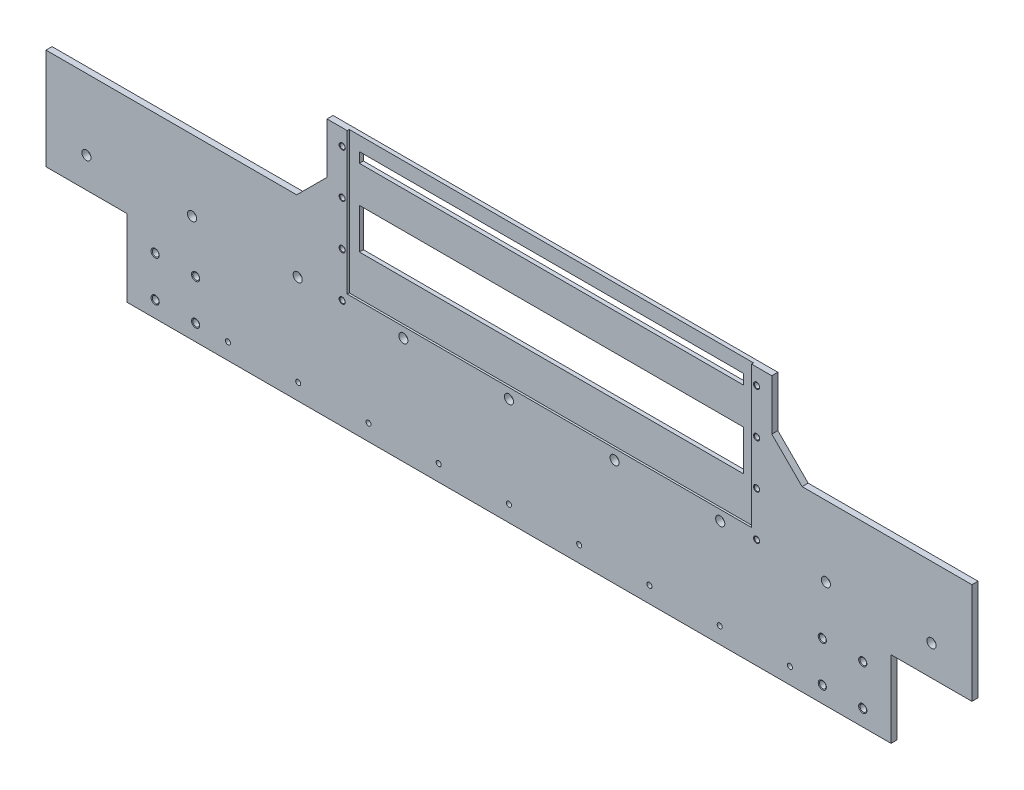
from build123d import *

# Parameters (mm, degrees)
EXTRUDE_1_DEPTH             = 3
SKETCH_2_W                  = 190
SKETCH_2_H                  = 5
SKETCH_2_H_2                = 20
CUT_EXTRUDE_1_DEPTH         = 4
SKETCH_3_W                  = 200
SKETCH_3_H                  = 70
CUT_EXTRUDE_2_DEPTH         = 1
EXTRUDE_2_DEPTH             = 3
CHAMFER_1_SIZE              = 15
HOLE_WIZARD_M41_D           = 3.3
HOLE_WIZARD_M41_DEPTH       = 11.5
HOLE_WIZARD_M41_CSINK_D     = 4.05
HOLE_WIZARD_M41_CSINK_ANGLE = 120
HOLE_WIZARD_M41_TIP         = 0.991420021
HOLE_WIZARD_M31_D           = 2.5
HOLE_WIZARD_M31_DEPTH       = 8.5
HOLE_WIZARD_M31_CSINK_D     = 3.05
HOLE_WIZARD_M31_CSINK_ANGLE = 120
HOLE_WIZARD_M31_TIP         = 0.751075774
HOLE_WIZARD_M32_D           = 2.5
HOLE_WIZARD_M32_DEPTH       = 8.5
HOLE_WIZARD_M32_CSINK_D     = 3.05
HOLE_WIZARD_M32_CSINK_ANGLE = 120
HOLE_WIZARD_M32_TIP         = 0.751075774
HOLE_WIZARD_M42_D           = 4.5
HOLE_WIZARD_M42_DEPTH       = 5
HOLE_WIZARD_M42_TIP         = 1.351936393


with BuildPart() as part:
    # Эскиз1 → Бобышка-Вытянуть1 (new body)
    with BuildSketch(Plane.XY):
        Polygon((259, 50), (298, 50), (298, 0), (0, 0), (0, 50), (39, 50), (39, 90), (259, 90), align=None)
    extrude(amount=EXTRUDE_1_DEPTH)

    # Эскиз2 → Вырез-Вытянуть1 (cut)
    with BuildSketch(Plane.XY.offset(3)):
        with Locations((149, 80.5)):
            Rectangle(SKETCH_2_W, SKETCH_2_H)
        with Locations((149, 50)):
            Rectangle(SKETCH_2_W, SKETCH_2_H_2)
    extrude(amount=-CUT_EXTRUDE_1_DEPTH, mode=Mode.SUBTRACT)

    # Эскиз3 → Вырез-Вытянуть2 (cut)
    with BuildSketch(Plane.XY.offset(3)):
        with Locations((149, 55)):
            Rectangle(SKETCH_3_W, SKETCH_3_H)
    extrude(amount=-CUT_EXTRUDE_2_DEPTH, mode=Mode.SUBTRACT)

    # Эскиз4 → Бобышка-Вытянуть2 (add)
    with BuildSketch(Plane.XY.offset(3)):
        Polygon((0, 50), (-100, 50), (-100, 0), (-60, 0), (-60, -38), (318, -38), (318, 0), (358, 0), (358, 50), (298, 50), (298, 0), (0, 0), align=None)
    extrude(amount=-EXTRUDE_2_DEPTH)

    # Фаска1
    chamfer_1_edges = [part.edges().sort_by_distance(p)[0] for p in [
        (39, 50, 1.5),
        (259, 50, 1.5),
    ]]
    chamfer(chamfer_1_edges, length=CHAMFER_1_SIZE)

    # Отверстие обработанное метчиком M41
    with Locations(Plane.XY.offset(3)):
        with Locations((-46, -30), (-26, -30), (-46, -10), (-26, -10), (284, -10), (304, -10), (304, -30), (284, -30)):
            CounterSinkHole(HOLE_WIZARD_M41_D / 2, HOLE_WIZARD_M41_CSINK_D / 2, depth=HOLE_WIZARD_M41_DEPTH, counter_sink_angle=HOLE_WIZARD_M41_CSINK_ANGLE)
            with Locations((0, 0, -(HOLE_WIZARD_M41_DEPTH + HOLE_WIZARD_M41_TIP / 2))):  # 118° drill point
                Cone(0, HOLE_WIZARD_M41_D / 2, HOLE_WIZARD_M41_TIP, mode=Mode.SUBTRACT)

    # Отверстие обработанное метчиком M31
    with Locations(Plane(origin=(0, 0, 0), x_dir=(-1, 0, 0), z_dir=(0, 0, -1))):
        with Locations((-268, -30), (-233.25, -30), (-198.5, -30), (-163.75, -30), (-129, -30), (-94.25, -30), (-59.5, -30), (-24.75, -30), (10, -30)):
            CounterSinkHole(HOLE_WIZARD_M31_D / 2, HOLE_WIZARD_M31_CSINK_D / 2, depth=HOLE_WIZARD_M31_DEPTH, counter_sink_angle=HOLE_WIZARD_M31_CSINK_ANGLE)
            with Locations((0, 0, -(HOLE_WIZARD_M31_DEPTH + HOLE_WIZARD_M31_TIP / 2))):  # 118° drill point
                Cone(0, HOLE_WIZARD_M31_D / 2, HOLE_WIZARD_M31_TIP, mode=Mode.SUBTRACT)

    # Отверстие обработанное метчиком M32
    with Locations(Plane.XY.offset(3)):
        with Locations((251.5, 82), (46.5, 82), (251.5, 60), (46.5, 60), (251.5, 38), (46.5, 38), (251.5, 16), (46.5, 16)):
            CounterSinkHole(HOLE_WIZARD_M32_D / 2, HOLE_WIZARD_M32_CSINK_D / 2, depth=HOLE_WIZARD_M32_DEPTH, counter_sink_angle=HOLE_WIZARD_M32_CSINK_ANGLE)
            with Locations((0, 0, -(HOLE_WIZARD_M32_DEPTH + HOLE_WIZARD_M32_TIP / 2))):  # 118° drill point
                Cone(0, HOLE_WIZARD_M32_D / 2, HOLE_WIZARD_M32_TIP, mode=Mode.SUBTRACT)

    # Отверстие с зазором M42
    with Locations(Plane.XY.offset(3)):
        with Locations((338, 15), (285.75, 15), (233.5, 15), (181.25, 15), (129, 15), (76.75, 15), (24.5, 15), (-27.75, 15), (-80, 15)):
            Hole(HOLE_WIZARD_M42_D / 2, depth=HOLE_WIZARD_M42_DEPTH)
            with Locations((0, 0, -(HOLE_WIZARD_M42_DEPTH + HOLE_WIZARD_M42_TIP / 2))):  # 118° drill point
                Cone(0, HOLE_WIZARD_M42_D / 2, HOLE_WIZARD_M42_TIP, mode=Mode.SUBTRACT)


solid = part.part
